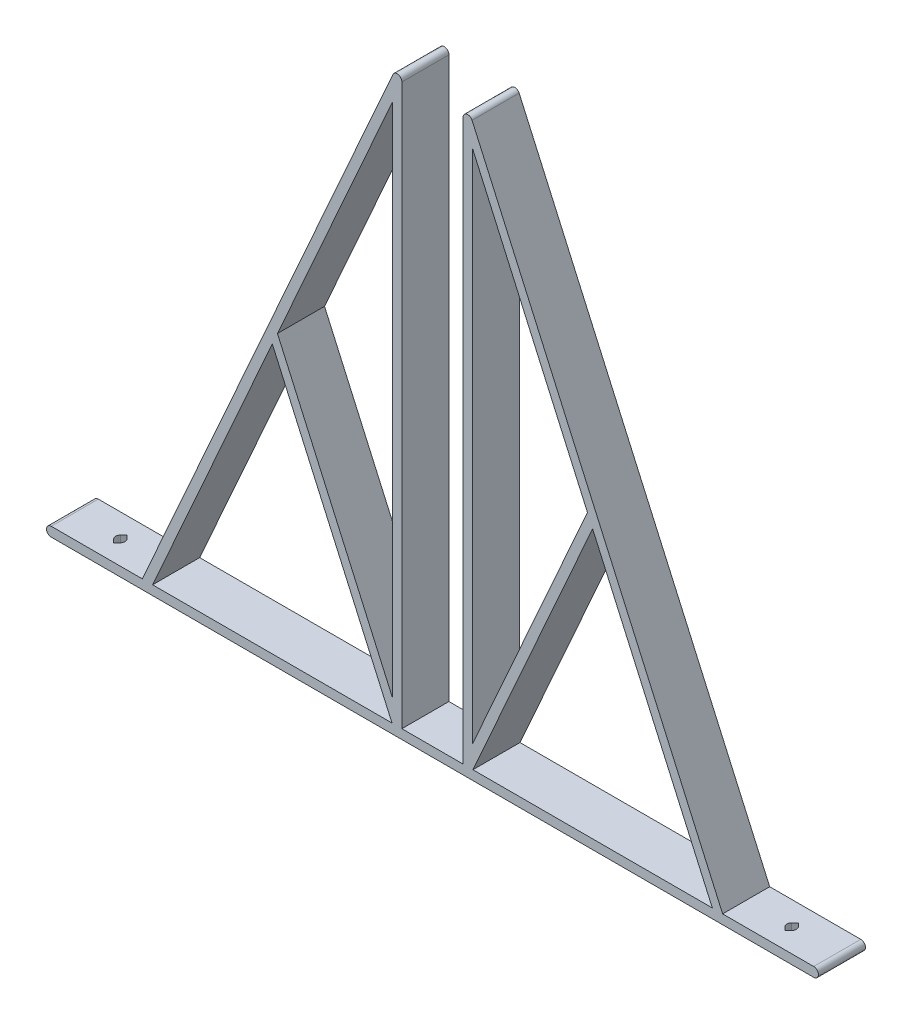
from build123d import *

# Parameters (mm, degrees)
BOSS_EXTRUDE1_DEPTH = 10
CUT_EXTRUDE1_REACH  = 151.3
FILLET1_R           = 1
FILLET2_R           = 1


with BuildPart() as part:
    # Sketch2 → Boss-Extrude1 (new body)
    with BuildSketch(Plane.XY):
        with BuildLine():
            Line((0, -1), (60, -1))
            Line((60, -1), (80, -1))
            ThreePointArc((80, -1), (81, 0), (80, 1))
            Line((80, 1), (60.649049017, 1))
            Line((60.649049017, 1), (5.5, 124.698801533))
            Line((5.5, 124.698801533), (5.5, 1))
            Line((5.5, 1), (0, 1))
            Line((0, 1), (-2, 1))
            Line((-2, 1), (-7.5, 1))
            Line((-7.5, 1), (-7.5, 124.698801533))
            Line((-7.5, 124.698801533), (-62.649049017, 1))
            Line((-62.649049017, 1), (-82, 1))
            ThreePointArc((-82, 1), (-83, 0), (-82, -1))
            Line((-82, -1), (-62, -1))
            Line((-62, -1), (-2, -1))
            Line((-2, -1), (0, -1))
        make_face()
        Polygon((7.59488235, 1), (58.459284316, 1), (33.027083333, 58.044189121), align=None, mode=Mode.SUBTRACT)
        Polygon((31.932200983, 60.5), (7.5, 5.698801533), (7.5, 115.301198467), align=None, mode=Mode.SUBTRACT)
        Polygon((-35.027083333, 58.044189121), (-9.59488235, 1), (-60.459284316, 1), align=None, mode=Mode.SUBTRACT)
        Polygon((-9.5, 115.301198467), (-33.932200983, 60.5), (-9.5, 5.698801533), align=None, mode=Mode.SUBTRACT)
    extrude(amount=BOSS_EXTRUDE1_DEPTH)

    # Sketch3 → Cut-Extrude1 (cut, up to next)
    with BuildSketch(Plane(origin=(0, 1, 0), x_dir=(1, 0, 0), z_dir=(0, 1, 0)), mode=Mode.PRIVATE) as cut_extrude1_sk1:
        with BuildLine():
            Line((-72.324524509, -3.585786438), (-73.03163129, -4.292893219))
            ThreePointArc((-73.03163129, -4.292893219), (-73.324524509, -5), (-73.03163129, -5.707106781))
            Line((-73.03163129, -5.707106781), (-72.324524509, -6.414213562))
            Line((-72.324524509, -6.414213562), (-71.617417727, -5.707106781))
            ThreePointArc((-71.617417727, -5.707106781), (-71.324524509, -5), (-71.617417727, -4.292893219))
            Line((-71.617417727, -4.292893219), (-72.324524509, -3.585786438))
        make_face()
    cut_extrude1_tool1 = extrude(cut_extrude1_sk1.sketch, amount=-CUT_EXTRUDE1_REACH, mode=Mode.PRIVATE) & part.part
    # Sketch3 → Cut-Extrude1 (cut, up to next)
    with BuildSketch(Plane(origin=(0, 1, 0), x_dir=(1, 0, 0), z_dir=(0, 1, 0)), mode=Mode.PRIVATE) as cut_extrude1_sk2:
        with BuildLine():
            Line((69.617417727, -5.707106781), (70.324524509, -6.414213562))
            Line((70.324524509, -6.414213562), (71.03163129, -5.707106781))
            ThreePointArc((71.03163129, -5.707106781), (71.324524509, -5), (71.03163129, -4.292893219))
            Line((71.03163129, -4.292893219), (70.324524509, -3.585786438))
            Line((70.324524509, -3.585786438), (69.617417727, -4.292893219))
            ThreePointArc((69.617417727, -4.292893219), (69.324524509, -5), (69.617417727, -5.707106781))
        make_face()
    cut_extrude1_tool2 = extrude(cut_extrude1_sk2.sketch, amount=-CUT_EXTRUDE1_REACH, mode=Mode.PRIVATE) & part.part
    add(cut_extrude1_tool1.solids().sort_by_distance((-72.324525, 1, 5))[0], mode=Mode.SUBTRACT)
    add(cut_extrude1_tool2.solids().sort_by_distance((70.324525, 1, 5))[0], mode=Mode.SUBTRACT)

    # Fillet1
    fillet1_edges = [part.edges().sort_by_distance(p)[0] for p in [
        (5.5, 124.698801533, 5),
    ]]
    fillet(fillet1_edges, radius=FILLET1_R)

    # Fillet2
    fillet2_edges = [part.edges().sort_by_distance(p)[0] for p in [
        (-7.5, 124.698801533, 5),
    ]]
    fillet(fillet2_edges, radius=FILLET2_R)


solid = part.part
